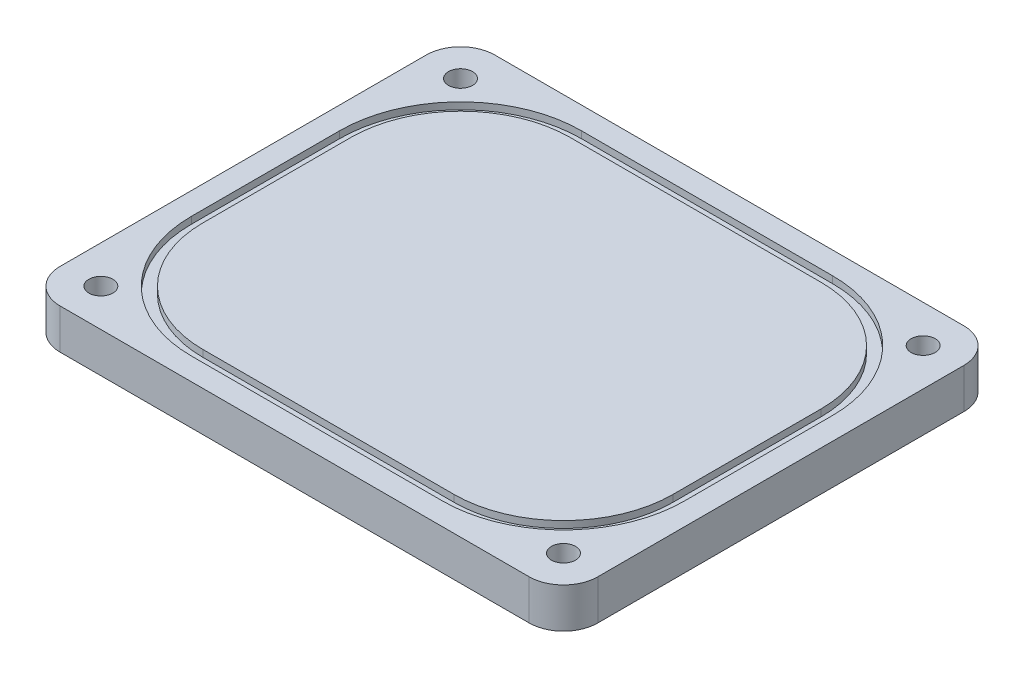
from build123d import *

# Parameters (mm, degrees)
SKETCH1_W               = 94
SKETCH1_H               = 76
BOSS_EXTRUDE1_DEPTH     = 7
FILLET1_R               = 6
CUT_EXTRUDE1_DEPTH      = 61.844062981
CUT_EXTRUDE1_DEPTH_BACK = 61.844062981
SKETCH2_R               = 2.1
CUT_EXTRUDE2_DEPTH      = 1.2
SKETCH4_R               = 4.2
CUT_EXTRUDE3_DEPTH      = 2.75
CUT_EXTRUDE4_DEPTH      = 0.25


with BuildPart() as part:
    # Sketch1 → Boss-Extrude1 (new body)
    with BuildSketch(Plane(origin=(0, 0, 0), x_dir=(1, 0, 0), z_dir=(0, 1, 0))):
        Rectangle(SKETCH1_W, SKETCH1_H)
    extrude(amount=BOSS_EXTRUDE1_DEPTH)

    # Fillet1
    fillet1_edges = [part.edges().sort_by_distance(p)[0] for p in [
        (47, 3.5, 38),
        (-47, 3.5, 38),
        (-47, 3.5, -38),
        (47, 3.5, -38),
    ]]
    fillet(fillet1_edges, radius=FILLET1_R)

    # Sketch2 → Cut-Extrude1 (cut, two sides: drawn at the far end of the back side and taken through both)
    with BuildSketch(Plane(origin=(0, 7, 0), x_dir=(1, 0, 0), z_dir=(0, 1, 0)).offset(-CUT_EXTRUDE1_DEPTH_BACK)):
        with Locations(Location((-40.44, 31.44, 0), (0, 0, 270))):
            Circle(SKETCH2_R)
        with Locations(Location((40.44, 31.44, 0), (0, 0, 270))):
            Circle(SKETCH2_R)
        with Locations(Location((40.44, -31.44, 0), (0, 0, 270))):
            Circle(SKETCH2_R)
        with Locations(Location((-40.44, -31.44, 0), (0, 0, 270))):
            Circle(SKETCH2_R)
    extrude(amount=CUT_EXTRUDE1_DEPTH + CUT_EXTRUDE1_DEPTH_BACK, mode=Mode.SUBTRACT)

    # Sketch3 → Cut-Extrude2 (cut)
    with BuildSketch(Plane(origin=(0, 7, 0), x_dir=(1, 0, 0), z_dir=(0, 1, 0))):
        with BuildLine():
            Line((-21.96, 34.1), (21.96, 34.1))
            ThreePointArc((21.96, 34.1), (36.908237354, 27.908237354), (43.1, 12.96))
            Line((43.1, 12.96), (43.1, -12.96))
            ThreePointArc((43.1, -12.96), (36.908237354, -27.908237354), (21.96, -34.1))
            Line((21.96, -34.1), (-21.96, -34.1))
            ThreePointArc((-21.96, -34.1), (-36.908237354, -27.908237354), (-43.1, -12.96))
            Line((-43.1, -12.96), (-43.1, 12.96))
            ThreePointArc((-43.1, 12.96), (-36.908237354, 27.908237354), (-21.96, 34.1))
        make_face()
        with BuildLine():
            Line((-41.1, -12.96), (-41.1, 12.96))
            ThreePointArc((-41.1, 12.96), (-35.494023792, 26.494023792), (-21.96, 32.1))
            Line((-21.96, 32.1), (21.96, 32.1))
            ThreePointArc((21.96, 32.1), (35.494023792, 26.494023792), (41.1, 12.96))
            Line((41.1, 12.96), (41.1, -12.96))
            ThreePointArc((41.1, -12.96), (35.494023792, -26.494023792), (21.96, -32.1))
            Line((21.96, -32.1), (-21.96, -32.1))
            ThreePointArc((-21.96, -32.1), (-35.494023792, -26.494023792), (-41.1, -12.96))
        make_face(mode=Mode.SUBTRACT)
    extrude(amount=-CUT_EXTRUDE2_DEPTH, mode=Mode.SUBTRACT)

    # Sketch4 → Cut-Extrude3 (cut)
    with BuildSketch(Plane.XZ):
        with Locations(Location((-40.44, 31.44, 0), (0, 0, 270))):
            Circle(SKETCH4_R)
        with Locations(Location((40.44, 31.44, 0), (0, 0, 270))):
            Circle(SKETCH4_R)
        with Locations(Location((40.44, -31.44, 0), (0, 0, 270))):
            Circle(SKETCH4_R)
        with Locations(Location((-40.44, -31.44, 0), (0, 0, 270))):
            Circle(SKETCH4_R)
    extrude(amount=-CUT_EXTRUDE3_DEPTH, mode=Mode.SUBTRACT)

    # Sketch5 → Cut-Extrude4 (cut)
    with BuildSketch(Plane.XZ):
        Polygon((-6.835236378, 3.5), (-6.183193109, 3.5), (-5.384615385, 1.05869391), (-4.580428686, 3.5), (-3.934695513, 3.5), (-3.342948718, 0), (-3.978866186, 0), (-4.352564103, 2.210637019), (-5.080328526, 0), (-5.693108974, 0), (-6.416666667, 2.210637019), (-6.789663462, 0), (-7.426282051, 0), align=None)
        with BuildLine():
            Line((-0.96474359, 3.032351763), (-1.434495192, 2.602564103))
            add(Edge.make_bspline(
                [(-1.434495192, 2.602564103), (-1.454617337, 2.630948479), (-1.493249048, 2.685442524), (-1.555867022, 2.758411334), (-1.618202244, 2.82065916), (-1.680832212, 2.871925958), (-1.744312054, 2.911900244), (-1.808531577, 2.940202481), (-1.873126705, 2.958194481), (-1.916524659, 2.960434918), (-1.937900641, 2.961538462)],
                knots=[0, 0, 0, 0, 1.299362458, 2.494594718, 3.587462134, 4.587049575, 5.512617175, 6.380583204, 7.202344345, 8, 8, 8, 8], degree=3))
            add(Edge.make_bspline(
                [(-1.937900641, 2.961538462), (-1.957839544, 2.960839206), (-1.996336326, 2.959489126), (-2.051216345, 2.946069437), (-2.099939608, 2.922909025), (-2.142458562, 2.892624837), (-2.176139847, 2.856139412), (-2.203031741, 2.817875583), (-2.218174137, 2.775640968), (-2.220167174, 2.746632532), (-2.221153846, 2.732271635)],
                knots=[0, 0, 0, 0, 1.185010067, 2.2879431, 3.333075148, 4.379039566, 5.372662701, 6.27520591, 7.14612461, 8, 8, 8, 8], degree=3))
            add(Edge.make_bspline(
                [(-2.221153846, 2.732271635), (-2.220535549, 2.717703647), (-2.219290385, 2.688365745), (-2.207263791, 2.645367395), (-2.18913628, 2.603353002), (-2.171814703, 2.577776842), (-2.162960737, 2.564703526)],
                knots=[0, 0, 0, 0, 0.967525499, 1.948461899, 2.951351359, 4, 4, 4, 4], degree=3))
            add(Edge.make_bspline(
                [(-2.162960737, 2.564703526), (-2.154911525, 2.554541774), (-2.1363833, 2.531150764), (-2.101053771, 2.49410305), (-2.056687302, 2.448716357), (-2.001576579, 2.396551401), (-1.938009398, 2.335732126), (-1.863039339, 2.268649361), (-1.778824368, 2.193225631), (-1.718966317, 2.140703276), (-1.68760016, 2.11318109)],
                knots=[0, 0, 0, 0, 0.473873513, 1.090794244, 1.870441696, 2.795289791, 3.865433203, 5.087734844, 6.473946851, 8, 8, 8, 8], degree=3))
            add(Edge.make_bspline(
                [(-1.68760016, 2.11318109), (-1.65815851, 2.087700826), (-1.602284374, 2.03934458), (-1.522786574, 1.970710653), (-1.452921248, 1.908962381), (-1.391670618, 1.855026476), (-1.339963184, 1.808337026), (-1.297581566, 1.768670855), (-1.264008146, 1.736800191), (-1.244923623, 1.717550291), (-1.236778846, 1.709334936)],
                knots=[0, 0, 0, 0, 1.543621617, 2.929473131, 4.163658386, 5.240097082, 6.164993805, 6.925417477, 7.541396219, 8, 8, 8, 8], degree=3))
            add(Edge.make_bspline(
                [(-1.236778846, 1.709334936), (-1.205879262, 1.675894968), (-1.146479409, 1.611611605), (-1.06928054, 1.511992611), (-1.005743374, 1.414744159), (-0.956589817, 1.318036363), (-0.919467074, 1.220473922), (-0.893295049, 1.119664122), (-0.877620449, 1.014553564), (-0.875880202, 0.942828439), (-0.875, 0.906550481)],
                knots=[0, 0, 0, 0, 1.206664779, 2.319633467, 3.337109185, 4.282041471, 5.190008762, 6.099243693, 7.03861361, 8, 8, 8, 8], degree=3))
            add(Edge.make_bspline(
                [(-0.875, 0.906550481), (-0.875626505, 0.871202059), (-0.876855732, 0.801847141), (-0.891911399, 0.700356549), (-0.913379898, 0.603225647), (-0.946573963, 0.511511358), (-0.987030692, 0.423708218), (-1.037749046, 0.341183923), (-1.097310798, 0.263103292), (-1.16557771, 0.190862112), (-1.241089022, 0.125308248), (-1.322082081, 0.06695065), (-1.409348877, 0.01876902), (-1.502143817, -0.020905116), (-1.600417229, -0.051462666), (-1.704052041, -0.074047543), (-1.813206769, -0.087602631), (-1.887848344, -0.089019654), (-1.925981571, -0.08974359)],
                knots=[0, 0, 0, 0, 1.043214005, 2.046824704, 3.02475056, 3.976699089, 4.921714032, 5.875962561, 6.831408892, 7.817874052, 8.806269674, 9.781291748, 10.760897367, 11.74438705, 12.757449933, 13.795994037, 14.874007457, 16, 16, 16, 16], degree=3))
            add(Edge.make_bspline(
                [(-1.925981571, -0.08974359), (-1.955915828, -0.089212536), (-2.015202826, -0.088160745), (-2.102582897, -0.079573749), (-2.186958234, -0.065715249), (-2.268233795, -0.04585188), (-2.346775741, -0.020682298), (-2.422587297, 0.010061383), (-2.495145111, 0.046855678), (-2.564998189, 0.08894395), (-2.631806961, 0.137813977), (-2.696416196, 0.192466629), (-2.758184134, 0.253742487), (-2.817407434, 0.321496636), (-2.873707169, 0.39592094), (-2.928926231, 0.475978902), (-2.980610518, 0.56315629), (-3.012538202, 0.624311933), (-3.028846154, 0.655548878)],
                knots=[0, 0, 0, 0, 1.016823716, 2.013894106, 2.979844003, 3.91962641, 4.853723003, 5.779685073, 6.695824784, 7.614987388, 8.547259901, 9.504950863, 10.487499108, 11.500346958, 12.559593716, 13.656357062, 14.802919212, 16, 16, 16, 16], degree=3))
            Line((-3.028846154, 0.655548878), (-2.476362179, 0.987179487))
            add(Edge.make_bspline(
                [(-2.476362179, 0.987179487), (-2.455963369, 0.951721473), (-2.416857105, 0.88374543), (-2.350587886, 0.792411001), (-2.282698454, 0.714198182), (-2.211619267, 0.650489388), (-2.13821462, 0.600432751), (-2.062129952, 0.564658806), (-1.983311809, 0.542514774), (-1.92962447, 0.539810476), (-1.902844551, 0.538461538)],
                knots=[0, 0, 0, 0, 1.283663364, 2.460892379, 3.537111102, 4.529833553, 5.449777664, 6.316464042, 7.160231139, 8, 8, 8, 8], degree=3))
            add(Edge.make_bspline(
                [(-1.902844551, 0.538461538), (-1.87560554, 0.539563154), (-1.822757892, 0.541700449), (-1.747324637, 0.561441996), (-1.678164572, 0.592437673), (-1.618383123, 0.63666423), (-1.567763961, 0.687708399), (-1.530404114, 0.744497371), (-1.506934406, 0.805941668), (-1.504453089, 0.848624918), (-1.503205128, 0.870092147)],
                knots=[0, 0, 0, 0, 1.13588714, 2.203786484, 3.234766741, 4.283437687, 5.291419208, 6.222934724, 7.106237994, 8, 8, 8, 8], degree=3))
            add(Edge.make_bspline(
                [(-1.503205128, 0.870092147), (-1.504357568, 0.890063911), (-1.506698641, 0.930634636), (-1.523942256, 0.99095678), (-1.550899288, 1.051251492), (-1.582791356, 1.100706845), (-1.61524553, 1.142114472), (-1.646279039, 1.177992307), (-1.684069645, 1.217631034), (-1.728521526, 1.261080516), (-1.779047357, 1.308723248), (-1.8356897, 1.360554566), (-1.899097169, 1.416117898), (-1.943913693, 1.45396709), (-1.967347756, 1.473758013)],
                knots=[0, 0, 0, 0, 0.916159276, 1.861089862, 2.860218735, 3.940849679, 4.552606315, 5.27541173, 6.11797699, 7.06649574, 8.129236253, 9.306560635, 10.591630461, 12, 12, 12, 12], degree=3))
            add(Edge.make_bspline(
                [(-1.967347756, 1.473758013), (-2.011896843, 1.511450812), (-2.097400024, 1.583794702), (-2.218226866, 1.69064435), (-2.32710267, 1.790505137), (-2.423087066, 1.88461156), (-2.507403046, 1.971225691), (-2.579479583, 2.051051045), (-2.638524885, 2.124703364), (-2.700657334, 2.211939606), (-2.759695583, 2.318242962), (-2.810721383, 2.446138223), (-2.843824769, 2.574017255), (-2.847533543, 2.659868194), (-2.849358974, 2.702123397)],
                knots=[0, 0, 0, 0, 1.345494975, 2.582412109, 3.71882943, 4.751509156, 5.681369928, 6.505683931, 7.230279997, 7.856715994, 8.973648664, 10.023341002, 11.027102913, 12, 12, 12, 12], degree=3))
            add(Edge.make_bspline(
                [(-2.849358974, 2.702123397), (-2.84859978, 2.73208852), (-2.847104085, 2.79112303), (-2.833762258, 2.877924675), (-2.813822389, 2.961680969), (-2.784863974, 3.042086331), (-2.747279448, 3.119040051), (-2.701634502, 3.192918848), (-2.647220355, 3.263042759), (-2.585899285, 3.329365297), (-2.518339165, 3.389976549), (-2.446142592, 3.443472052), (-2.369718204, 3.488655132), (-2.289533527, 3.526137778), (-2.20509169, 3.554828362), (-2.117014771, 3.575165678), (-2.025176442, 3.587261665), (-1.962709992, 3.588905974), (-1.930889423, 3.58974359)],
                knots=[0, 0, 0, 0, 1.010766082, 1.991317756, 2.957454644, 3.913069143, 4.869106762, 5.843196583, 6.838735724, 7.860187025, 8.887984031, 9.89767229, 10.887916223, 11.879572884, 12.879850636, 13.892031539, 14.926195476, 16, 16, 16, 16], degree=3))
            add(Edge.make_bspline(
                [(-1.930889423, 3.58974359), (-1.88965154, 3.58823502), (-1.807501293, 3.585229789), (-1.686039782, 3.561729864), (-1.567401256, 3.524773756), (-1.471800109, 3.480190278), (-1.395732061, 3.437002242), (-1.337433007, 3.397240139), (-1.278110583, 3.351690512), (-1.217286388, 3.300209824), (-1.156090631, 3.24182811), (-1.092783223, 3.177935192), (-1.028226806, 3.107978887), (-0.986275371, 3.058002427), (-0.96474359, 3.032351763)],
                knots=[0, 0, 0, 0, 1.282922637, 2.555718331, 3.837320111, 5.142675274, 5.830281639, 6.55870424, 7.337177975, 8.157850921, 9.037902056, 9.96903443, 10.957596896, 12, 12, 12, 12], degree=3))
        make_face()
        with BuildLine():
            Line((2.96083734, 2.943309295), (2.485476763, 2.48828125))
            add(Edge.make_bspline(
                [(2.485476763, 2.48828125), (2.447841636, 2.52596147), (2.373995305, 2.599896282), (2.253228868, 2.696127521), (2.128151491, 2.777943098), (1.998351494, 2.845217589), (1.863648065, 2.897401533), (1.724307031, 2.934730378), (1.580101702, 2.956870748), (1.482481132, 2.959970324), (1.433092949, 2.961538462)],
                knots=[0, 0, 0, 0, 1.075575784, 2.110457258, 3.113929901, 4.09197124, 5.059417775, 6.02750972, 7.002078037, 8, 8, 8, 8], degree=3))
            add(Edge.make_bspline(
                [(1.433092949, 2.961538462), (1.390274904, 2.960439675), (1.306197919, 2.958282111), (1.182654888, 2.941897718), (1.064601954, 2.914528327), (0.951481386, 2.876612606), (0.843983825, 2.827272269), (0.74148641, 2.767268826), (0.64461991, 2.696143247), (0.55414708, 2.615243825), (0.471771277, 2.526917989), (0.399852852, 2.432378112), (0.338593804, 2.333386338), (0.288165114, 2.229436209), (0.249794364, 2.120687268), (0.22240267, 2.007218462), (0.205015756, 1.889359546), (0.202962881, 1.808954974), (0.201923077, 1.768229167)],
                knots=[0, 0, 0, 0, 1.075001177, 2.110859044, 3.123021556, 4.114053297, 5.101481495, 6.087880186, 7.091499647, 8.114004866, 9.131394192, 10.11971144, 11.092043119, 12.050101265, 13.015322563, 13.981809771, 14.977764287, 16, 16, 16, 16], degree=3))
            add(Edge.make_bspline(
                [(0.201923077, 1.768229167), (0.202892956, 1.726093785), (0.204803752, 1.643081314), (0.223159101, 1.521256945), (0.251438676, 1.404053124), (0.292832434, 1.292339475), (0.343775614, 1.184585677), (0.40837996, 1.082879025), (0.483715092, 0.985666345), (0.569646397, 0.894640167), (0.663117466, 0.810735938), (0.764349675, 0.73835799), (0.870262919, 0.675911444), (0.982566643, 0.626455798), (1.099311587, 0.586748333), (1.22168188, 0.558751162), (1.349401973, 0.541574995), (1.436544241, 0.539509688), (1.480769231, 0.538461538)],
                knots=[0, 0, 0, 0, 1.022067601, 2.013613092, 2.983553406, 3.943623673, 4.90013463, 5.87121881, 6.861774014, 7.881098904, 8.905697761, 9.905387765, 10.89678721, 11.884561068, 12.87834324, 13.885584958, 14.926927371, 16, 16, 16, 16], degree=3))
            add(Edge.make_bspline(
                [(1.480769231, 0.538461538), (1.509535949, 0.538721096), (1.566011417, 0.539230664), (1.648851304, 0.547502392), (1.728192019, 0.559327788), (1.804340826, 0.574983209), (1.876528826, 0.597138439), (1.945755512, 0.623046251), (2.011615277, 0.653622636), (2.073751035, 0.689922536), (2.133087547, 0.730610285), (2.189069412, 0.777165724), (2.242678617, 0.828539196), (2.293288746, 0.885358303), (2.340043207, 0.948131074), (2.384439895, 1.015703976), (2.425970476, 1.088747628), (2.450509801, 1.140327356), (2.463040865, 1.166666667)],
                knots=[0, 0, 0, 0, 1.109579412, 2.178351274, 3.208885622, 4.204702371, 5.174744997, 6.119429583, 7.05542196, 7.97267548, 8.893247984, 9.828544973, 10.778894627, 11.756245826, 12.760884819, 13.796418446, 14.874735809, 16, 16, 16, 16], degree=3))
            Line((2.463040865, 1.166666667), (1.458333333, 1.166666667))
            Line((1.458333333, 1.166666667), (1.458333333, 1.794871795))
            Line((1.458333333, 1.794871795), (3.203425481, 1.794871795))
            Line((3.203425481, 1.794871795), (3.208333333, 1.645532853))
            add(Edge.make_bspline(
                [(3.208333333, 1.645532853), (3.207702711, 1.607178823), (3.206442591, 1.53053921), (3.194926419, 1.416435882), (3.175850056, 1.303845899), (3.14977084, 1.192882342), (3.117086987, 1.083000895), (3.075404842, 0.975253766), (3.026595306, 0.868910248), (2.971907683, 0.764422219), (2.91045453, 0.664163115), (2.844291187, 0.569230978), (2.774360859, 0.479790116), (2.699142588, 0.397086663), (2.619807648, 0.320425875), (2.536199867, 0.250102674), (2.448023528, 0.186057559), (2.355745736, 0.127749495), (2.258840881, 0.076645917), (2.157841746, 0.032192583), (2.052900824, -0.005560694), (1.943747185, -0.036510169), (1.830595613, -0.060390151), (1.713443687, -0.076764686), (1.592227063, -0.087891367), (1.510008392, -0.089118718), (1.468149038, -0.08974359)],
                knots=[0, 0, 0, 0, 1.006889344, 2.011981806, 3.007738725, 4.003571281, 5.003404394, 6.015442001, 7.03424805, 8.074616296, 9.110249922, 10.119753985, 11.111721717, 12.089233633, 13.052717867, 14.006597561, 14.955430184, 15.912305663, 16.870361111, 17.829300583, 18.807640451, 19.796414044, 20.806216501, 21.841577364, 22.90109906, 24, 24, 24, 24], degree=3))
            add(Edge.make_bspline(
                [(1.468149038, -0.08974359), (1.423487947, -0.089126517), (1.334956342, -0.087903296), (1.204050499, -0.076446992), (1.076942316, -0.057539102), (0.953600089, -0.031371228), (0.833737443, 0.001196781), (0.717560319, 0.042077336), (0.605306333, 0.090706049), (0.496639334, 0.145795213), (0.392948207, 0.208271123), (0.294465339, 0.277038258), (0.201728269, 0.352538964), (0.113787082, 0.433509344), (0.032696423, 0.521939657), (-0.044565639, 0.614963447), (-0.114256021, 0.715992457), (-0.179371204, 0.821751296), (-0.237220053, 0.932195645), (-0.287809703, 1.04528278), (-0.330952528, 1.160357925), (-0.364971688, 1.277956909), (-0.39259206, 1.397259733), (-0.412354954, 1.518785217), (-0.423515984, 1.64251815), (-0.425355936, 1.72567309), (-0.426282051, 1.767528045)],
                knots=[0, 0, 0, 0, 1.084149091, 2.14910686, 3.187506334, 4.202448172, 5.208724393, 6.201130722, 7.189831603, 8.176984443, 9.156919086, 10.126598231, 11.090766514, 12.05840148, 13.026036446, 14.001772938, 14.991905635, 16.003017641, 17.015720547, 18.016462227, 19.009322657, 19.99686681, 20.986544154, 21.980959929, 22.983742515, 24, 24, 24, 24], degree=3))
            add(Edge.make_bspline(
                [(-0.426282051, 1.767528045), (-0.425041785, 1.824627147), (-0.422592626, 1.937380945), (-0.399909701, 2.103468005), (-0.3645504, 2.264140663), (-0.313806243, 2.418813761), (-0.248689507, 2.567700363), (-0.17012263, 2.711149986), (-0.076398967, 2.849010157), (-0.003850415, 2.93436475), (0.032952724, 2.977664263)],
                knots=[0, 0, 0, 0, 1.034044851, 2.041932006, 3.031217818, 4.011390712, 4.986069675, 5.97149666, 6.970960976, 8, 8, 8, 8], degree=3))
            add(Edge.make_bspline(
                [(0.032952724, 2.977664263), (0.055803434, 3.002714344), (0.101161749, 3.052438377), (0.173666933, 3.121530933), (0.248010869, 3.186480492), (0.325223232, 3.245909839), (0.40489813, 3.301119911), (0.487264884, 3.351075751), (0.571891415, 3.39736798), (0.659437707, 3.437632741), (0.749445445, 3.473733458), (0.842313258, 3.504279741), (0.937345585, 3.531336486), (1.035383941, 3.551919731), (1.135437904, 3.569059886), (1.238217692, 3.580548115), (1.343443222, 3.588968169), (1.414612478, 3.589483072), (1.450620994, 3.58974359)],
                knots=[0, 0, 0, 0, 1.020590567, 2.025856924, 3.013483481, 3.991664875, 4.957826714, 5.930500614, 6.890802512, 7.860442893, 8.829981142, 9.809047939, 10.802672283, 11.803273349, 12.823572789, 13.857849586, 14.916166035, 16, 16, 16, 16], degree=3))
            add(Edge.make_bspline(
                [(1.450620994, 3.58974359), (1.488261583, 3.589163107), (1.563152536, 3.58800816), (1.67450298, 3.580016678), (1.784306135, 3.567687706), (1.89209928, 3.549193543), (1.998244168, 3.526386391), (2.10219137, 3.497164785), (2.20461901, 3.463963776), (2.271299017, 3.437493479), (2.30458734, 3.424278846)],
                knots=[0, 0, 0, 0, 1.03180557, 2.052914215, 3.058998889, 4.059601663, 5.049854447, 6.033765722, 7.018406786, 8, 8, 8, 8], degree=3))
            add(Edge.make_bspline(
                [(2.30458734, 3.424278846), (2.332595346, 3.412066147), (2.389562855, 3.387225854), (2.47244356, 3.341779374), (2.555526765, 3.291396735), (2.63791596, 3.234235831), (2.719485608, 3.170403578), (2.801087382, 3.100908197), (2.881888261, 3.024939333), (2.934180165, 2.970871696), (2.96083734, 2.943309295)],
                knots=[0, 0, 0, 0, 0.894392155, 1.819168899, 2.76525314, 3.739198753, 4.75366411, 5.797420238, 6.877176959, 8, 8, 8, 8], degree=3))
        make_face()
        with BuildLine():
            Line((6.977564103, 2.892828526), (6.516927083, 2.452524038))
            add(Edge.make_bspline(
                [(6.516927083, 2.452524038), (6.477852099, 2.492927638), (6.401526412, 2.571848526), (6.278537007, 2.676332827), (6.150632504, 2.763406355), (6.020301029, 2.836739125), (5.885198298, 2.892220593), (5.746886466, 2.932650872), (5.604482371, 2.957299686), (5.508108756, 2.960119946), (5.459635417, 2.961538462)],
                knots=[0, 0, 0, 0, 1.115251505, 2.178435587, 3.19620269, 4.182487026, 5.141301733, 6.088180966, 7.038406374, 8, 8, 8, 8], degree=3))
            add(Edge.make_bspline(
                [(5.459635417, 2.961538462), (5.419154287, 2.960417785), (5.339269239, 2.958206253), (5.221977054, 2.941993543), (5.109781017, 2.914423124), (5.002297064, 2.876425979), (4.89984147, 2.82725969), (4.802199426, 2.766962311), (4.709611662, 2.696078413), (4.62330121, 2.614974752), (4.544347442, 2.526362907), (4.47458676, 2.431814281), (4.416150999, 2.331545478), (4.368193721, 2.226571947), (4.330836855, 2.116407818), (4.304159359, 2.00112726), (4.288729808, 1.88059298), (4.286426844, 1.798654675), (4.28525641, 1.757011218)],
                knots=[0, 0, 0, 0, 1.035432265, 2.043311493, 3.022114605, 3.98653278, 4.95457646, 5.923598177, 6.917315552, 7.932509744, 8.948865224, 9.949768934, 10.933144597, 11.912367597, 12.897413939, 13.903909035, 14.934704909, 16, 16, 16, 16], degree=3))
            add(Edge.make_bspline(
                [(4.28525641, 1.757011218), (4.285593716, 1.727782926), (4.286258552, 1.670173362), (4.293536364, 1.584952828), (4.305255356, 1.502268764), (4.322215641, 1.422246412), (4.343424645, 1.344816425), (4.368307635, 1.26931082), (4.399522981, 1.196772912), (4.434172485, 1.126360221), (4.47446946, 1.059994047), (4.517917032, 0.996708391), (4.56502883, 0.936813475), (4.616110001, 0.88055415), (4.671879448, 0.828809624), (4.730895737, 0.780023877), (4.794154391, 0.735418182), (4.860341369, 0.69387311), (4.930028441, 0.657782552), (5.001324836, 0.625091479), (5.07531155, 0.598541467), (5.151087752, 0.577139735), (5.228382644, 0.558940759), (5.307952241, 0.54773509), (5.389106775, 0.539249168), (5.443953618, 0.538725212), (5.471554487, 0.538461538)],
                knots=[0, 0, 0, 0, 1.103660481, 2.175337485, 3.227646561, 4.255952547, 5.262355991, 6.258840057, 7.255597736, 8.242457506, 9.22035537, 10.185017736, 11.140346927, 12.096287581, 13.051739095, 14.01125915, 14.986044842, 15.97314143, 16.960198552, 17.947847494, 18.933482797, 19.925264591, 20.920966487, 21.929612487, 22.958107872, 24, 24, 24, 24], degree=3))
            add(Edge.make_bspline(
                [(5.471554487, 0.538461538), (5.518370304, 0.5398157), (5.61035121, 0.542476276), (5.745346416, 0.563281603), (5.873983398, 0.597505189), (5.976763732, 0.637921255), (6.057289408, 0.677832645), (6.118592415, 0.714748715), (6.181984502, 0.756043392), (6.246412781, 0.803275183), (6.312601942, 0.855877287), (6.379383594, 0.915001788), (6.448467359, 0.978701801), (6.493723448, 1.024165752), (6.516927083, 1.047475962)],
                knots=[0, 0, 0, 0, 1.404581149, 2.759636711, 4.088442092, 5.392261763, 6.066678138, 6.783632037, 7.538459478, 8.336747902, 9.180226004, 10.074962426, 11.012997595, 12, 12, 12, 12], degree=3))
            Line((6.516927083, 1.047475962), (6.963541667, 0.578425481))
            add(Edge.make_bspline(
                [(6.963541667, 0.578425481), (6.932147065, 0.548114979), (6.870871518, 0.488955361), (6.778439055, 0.404954225), (6.686122922, 0.329469865), (6.596153285, 0.259762532), (6.507056346, 0.197862968), (6.418841555, 0.143709355), (6.332507542, 0.095932068), (6.246261552, 0.055336849), (6.159566919, 0.020867291), (6.07036833, -0.008808735), (5.978393096, -0.033913586), (5.883079475, -0.054169904), (5.785316493, -0.070412736), (5.684189219, -0.081376554), (5.580338851, -0.088747163), (5.509895537, -0.089409474), (5.474358974, -0.08974359)],
                knots=[0, 0, 0, 0, 1.244526981, 2.429050516, 3.560637417, 4.644440555, 5.67424972, 6.652764056, 7.595344123, 8.486817594, 9.369275933, 10.254498637, 11.166417451, 12.086725134, 13.032340136, 13.991389299, 14.986715468, 16, 16, 16, 16], degree=3))
            add(Edge.make_bspline(
                [(5.474358974, -0.08974359), (5.40908271, -0.088079568), (5.281355207, -0.084823539), (5.09417388, -0.06069857), (4.916356644, -0.020253485), (4.747470903, 0.036947022), (4.587570359, 0.110017988), (4.436695919, 0.199599561), (4.295090759, 0.305453737), (4.163898769, 0.426339803), (4.045229372, 0.559848314), (3.940339367, 0.703199828), (3.85357435, 0.857098866), (3.781531488, 1.019271846), (3.725194917, 1.190458828), (3.685543522, 1.370844982), (3.661090796, 1.560256136), (3.658415633, 1.689628321), (3.657051282, 1.755608974)],
                knots=[0, 0, 0, 0, 1.078019885, 2.10938526, 3.111377082, 4.085535484, 5.04941344, 6.010039228, 6.978205633, 7.964457913, 8.951525778, 9.924444315, 10.892603023, 11.863865945, 12.85144698, 13.863884204, 14.910567087, 16, 16, 16, 16], degree=3))
            add(Edge.make_bspline(
                [(3.657051282, 1.755608974), (3.65762779, 1.798640994), (3.658770289, 1.883919938), (3.670778057, 2.009542733), (3.687517582, 2.132002487), (3.714073318, 2.250027663), (3.746083639, 2.365208277), (3.785892677, 2.476292451), (3.833436855, 2.583599451), (3.887183709, 2.687308917), (3.947986988, 2.78674144), (4.015910925, 2.881042737), (4.089206894, 2.970940799), (4.169636077, 3.055242959), (4.256029733, 3.134689407), (4.348777919, 3.208849608), (4.447322802, 3.278787103), (4.551931105, 3.342698373), (4.660570568, 3.400509514), (4.771870962, 3.451501409), (4.885558834, 3.494118891), (5.001153502, 3.529468521), (5.119143352, 3.555854519), (5.238686202, 3.575827869), (5.360799218, 3.586993099), (5.44278753, 3.588820919), (5.484174679, 3.58974359)],
                knots=[0, 0, 0, 0, 1.071919942, 2.124283339, 3.142214191, 4.149696895, 5.136002878, 6.119640489, 7.086990633, 8.058538607, 9.028339693, 9.988281803, 10.952401235, 11.916291999, 12.888973767, 13.874849856, 14.873389453, 15.898127285, 16.927174885, 17.938320013, 18.946391617, 19.950418109, 20.947802303, 21.956882652, 22.968648068, 24, 24, 24, 24], degree=3))
            add(Edge.make_bspline(
                [(5.484174679, 3.58974359), (5.519482162, 3.589214692), (5.589730027, 3.588162395), (5.694340886, 3.579390354), (5.798115116, 3.565613953), (5.900681174, 3.544828298), (6.002772717, 3.520153099), (6.103048148, 3.487844329), (6.203089366, 3.451830117), (6.301327372, 3.408782479), (6.397899294, 3.361792095), (6.490542781, 3.308479797), (6.580813309, 3.252126365), (6.666710537, 3.189396556), (6.749843506, 3.122565697), (6.829777506, 3.051321984), (6.905811068, 2.974477576), (6.953525511, 2.920182466), (6.977564103, 2.892828526)],
                knots=[0, 0, 0, 0, 0.996412454, 1.982464992, 2.961075852, 3.949442424, 4.934965278, 5.923860011, 6.921385422, 7.934793307, 8.949617135, 9.951082467, 10.950285876, 11.951772932, 12.951063433, 13.960125323, 14.972308753, 16, 16, 16, 16], degree=3))
        make_face()
    extrude(amount=-CUT_EXTRUDE4_DEPTH, mode=Mode.SUBTRACT)


solid = part.part
